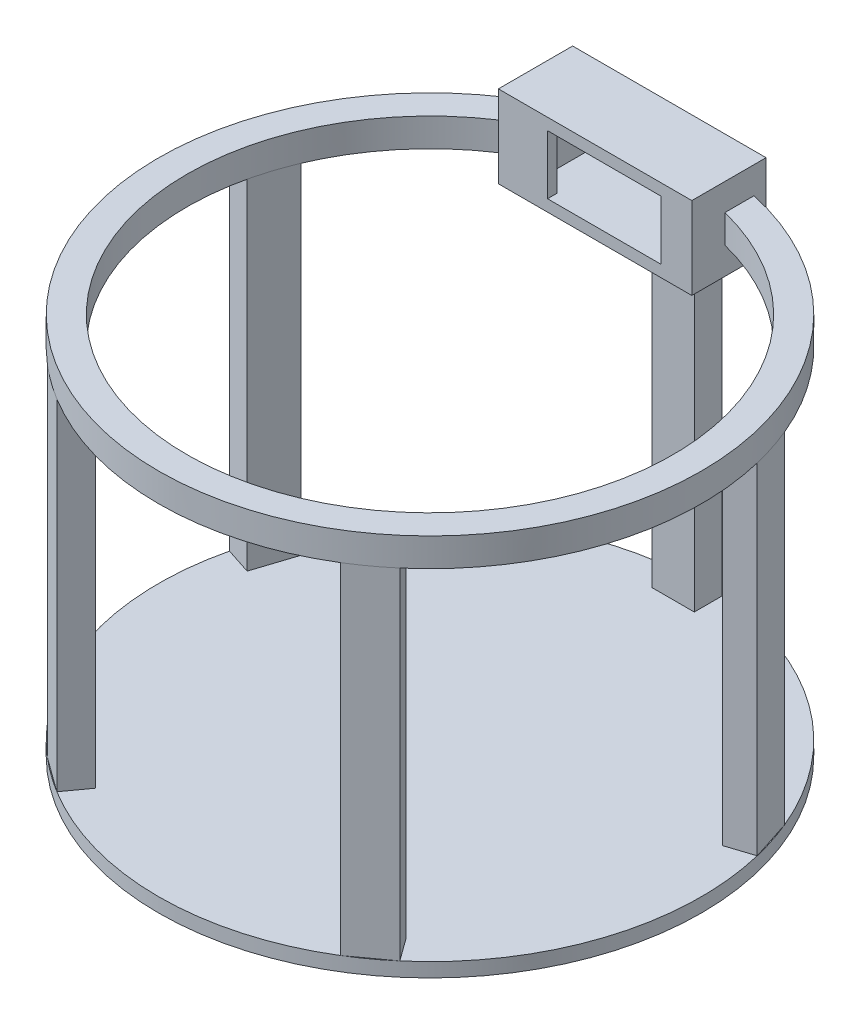
from build123d import *

# Parameters (mm, degrees)
SKETCH1_R                = 95.705
BOSS_EXTRUDE1_DEPTH      = 5
SKETCH2_W                = 15
SKETCH2_H                = 9.705675634
BOSS_EXTRUDE2_DEPTH      = 120
SKETCH3_R                = 95.705
SKETCH3_R_2              = 85.705
BOSS_EXTRUDE3_DEPTH      = 10
BOSS_EXTRUDE4_DEPTH      = 14.5
BOSS_EXTRUDE4_DEPTH_BACK = 14.5
SKETCH4_W                = 68.22
SKETCH4_H                = 26.18
SKETCH5_W                = 55
SKETCH5_H                = 20.8
CUT_EXTRUDE1_DEPTH       = 22.77
SKETCH6_W                = 40
SKETCH6_H                = 20.8
CUT_EXTRUDE2_DEPTH       = 5.77
SKETCH8_R                = 2.5
CUT_EXTRUDE3_DEPTH       = 5.77


with BuildPart() as part:
    # Sketch1 → Boss-Extrude1 (new body)
    with BuildSketch(Plane(origin=(0, 0, 0), x_dir=(1, 0, 0), z_dir=(0, 1, 0))):
        Circle(SKETCH1_R)
    extrude(amount=BOSS_EXTRUDE1_DEPTH)

    # Sketch2 → Boss-Extrude2 (add)
    with BuildSketch(Plane(origin=(0, 5, 0), x_dir=(1, 0, 0), z_dir=(0, 1, 0))):
        Polygon((83.827926187, 19.351377631), (93.058572244, 22.350596344), (88.423317328, 36.616444088), (79.192671271, 33.617225375), align=None)
        with Locations((0, 90.557837817)):
            Rectangle(SKETCH2_W, SKETCH2_H)
        Polygon((44.30850759, -73.745190895), (50.013360591, -81.597247425), (62.148615507, -72.780468641), (56.443762506, -64.928412111), align=None)
        Polygon((-56.443762506, -64.928412111), (-62.148615507, -72.780468641), (-50.013360591, -81.597247425), (-44.30850759, -73.745190895), align=None)
        Polygon((-79.192671271, 33.617225375), (-88.423317328, 36.616444088), (-93.058572244, 22.350596344), (-83.827926187, 19.351377631), align=None)
    extrude(amount=BOSS_EXTRUDE2_DEPTH)

    # Sketch3 → Boss-Extrude3 (add)
    with BuildSketch(Plane(origin=(0, 125, 0), x_dir=(1, 0, 0), z_dir=(0, 1, 0))):
        Circle(SKETCH3_R)
        Circle(SKETCH3_R_2, mode=Mode.SUBTRACT)
    extrude(amount=BOSS_EXTRUDE3_DEPTH)

    # Sketch4 → Boss-Extrude4 (add, two sides: drawn at the far end of the back side and taken through both)
    with BuildSketch(Plane(origin=(0, 130, 0), x_dir=(1, 0, 0), z_dir=(0, 1, 0)).offset(-BOSS_EXTRUDE4_DEPTH_BACK)):
        with Locations((-13.22, 84.54)):
            Rectangle(SKETCH4_W, SKETCH4_H)
    extrude(amount=BOSS_EXTRUDE4_DEPTH + BOSS_EXTRUDE4_DEPTH_BACK)

    # Sketch5 → Cut-Extrude1 (cut)
    with BuildSketch(Plane(origin=(0, 0, -97.63), x_dir=(-1, 0, 0), z_dir=(0, 0, -1))):
        with Locations((10, 130)):
            Rectangle(SKETCH5_W, SKETCH5_H)
    extrude(amount=-CUT_EXTRUDE1_DEPTH, mode=Mode.SUBTRACT)

    # Sketch6 → Cut-Extrude2 (cut)
    with BuildSketch(Plane(origin=(0, 0, -74.86), x_dir=(-1, 0, 0), z_dir=(0, 0, -1))):
        with Locations((10, 130)):
            Rectangle(SKETCH6_W, SKETCH6_H)
    extrude(amount=-CUT_EXTRUDE2_DEPTH, mode=Mode.SUBTRACT)

    # Sketch8 → Cut-Extrude3 (cut)
    with BuildSketch(Plane.XY.offset(90.705)):
        with Locations((0, 130)):
            Circle(SKETCH8_R)
    extrude(amount=-CUT_EXTRUDE3_DEPTH, mode=Mode.SUBTRACT)


solid = part.part
